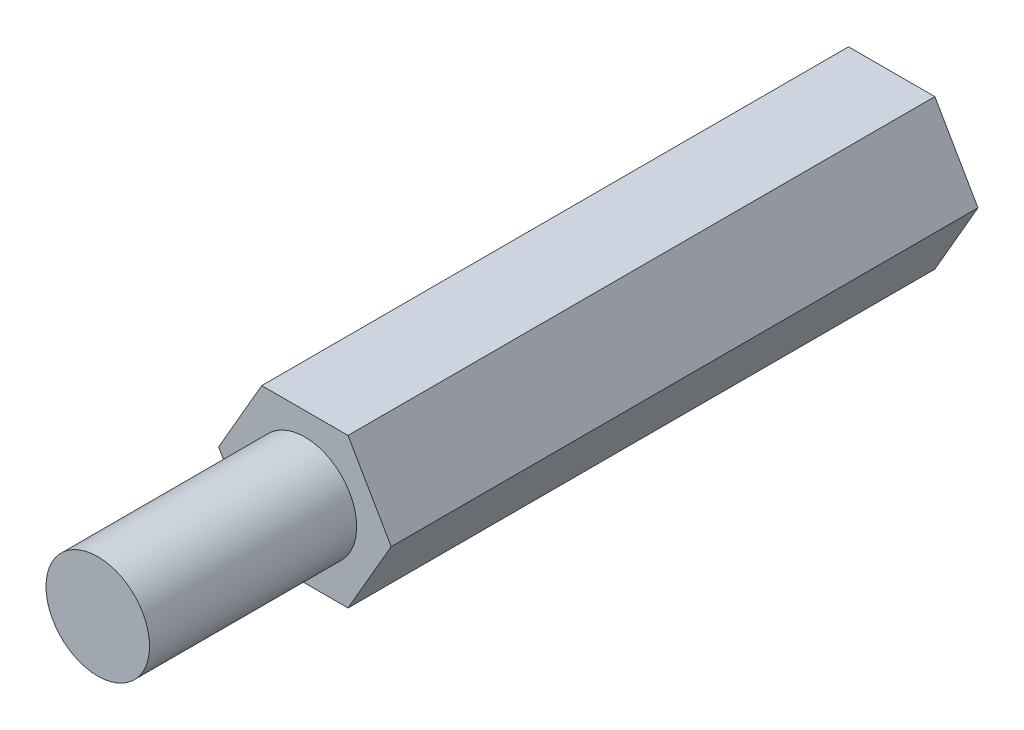
from build123d import *

# Parameters (mm, degrees)
EXTRUDE_1_DEPTH    = 17
HOLE_WIZARD_M3_1_D = 2.5
SKETCH_4_R         = 1.5
EXTRUDE_2_DEPTH    = 6


with BuildPart() as part:
    # 草图1 → 凸台-拉伸1 (new body)
    with BuildSketch(Plane.XY):
        Polygon((0, 0), (2.5, 0), (3.75, -2.165063509), (2.5, -4.330127019), (0, -4.330127019), (-1.25, -2.165063509), align=None)
    extrude(amount=EXTRUDE_1_DEPTH)

    # M3 螺纹孔1 (through all)
    with Locations(Plane.XY.offset(17)):
        with Locations((1.25, -2.165063509)):
            Hole(HOLE_WIZARD_M3_1_D / 2)

    # 草图4 → 凸台-拉伸2 (add)
    with BuildSketch(Plane.XY.offset(17)):
        with Locations(Location((1.25, -2.165063509, 0), (0, 0, 180))):
            Circle(SKETCH_4_R)
    extrude(amount=EXTRUDE_2_DEPTH)


solid = part.part
